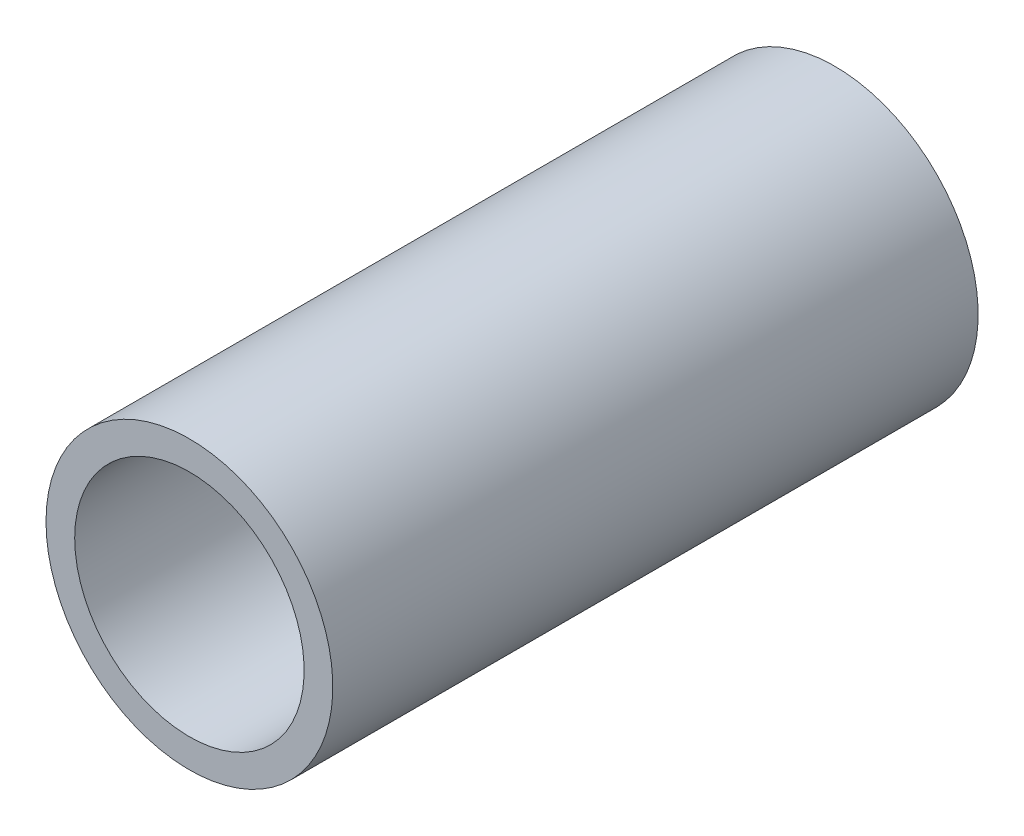
from build123d import *

# Parameters (mm, degrees)
SKETCH1_R           = 10
SKETCH1_R_2         = 8
BOSS_EXTRUDE1_DEPTH = 45


with BuildPart() as part:
    # Sketch1 → Boss-Extrude1 (new body)
    with BuildSketch(Plane.XY):
        Circle(SKETCH1_R)
        Circle(SKETCH1_R_2, mode=Mode.SUBTRACT)
    extrude(amount=BOSS_EXTRUDE1_DEPTH)


solid = part.part
